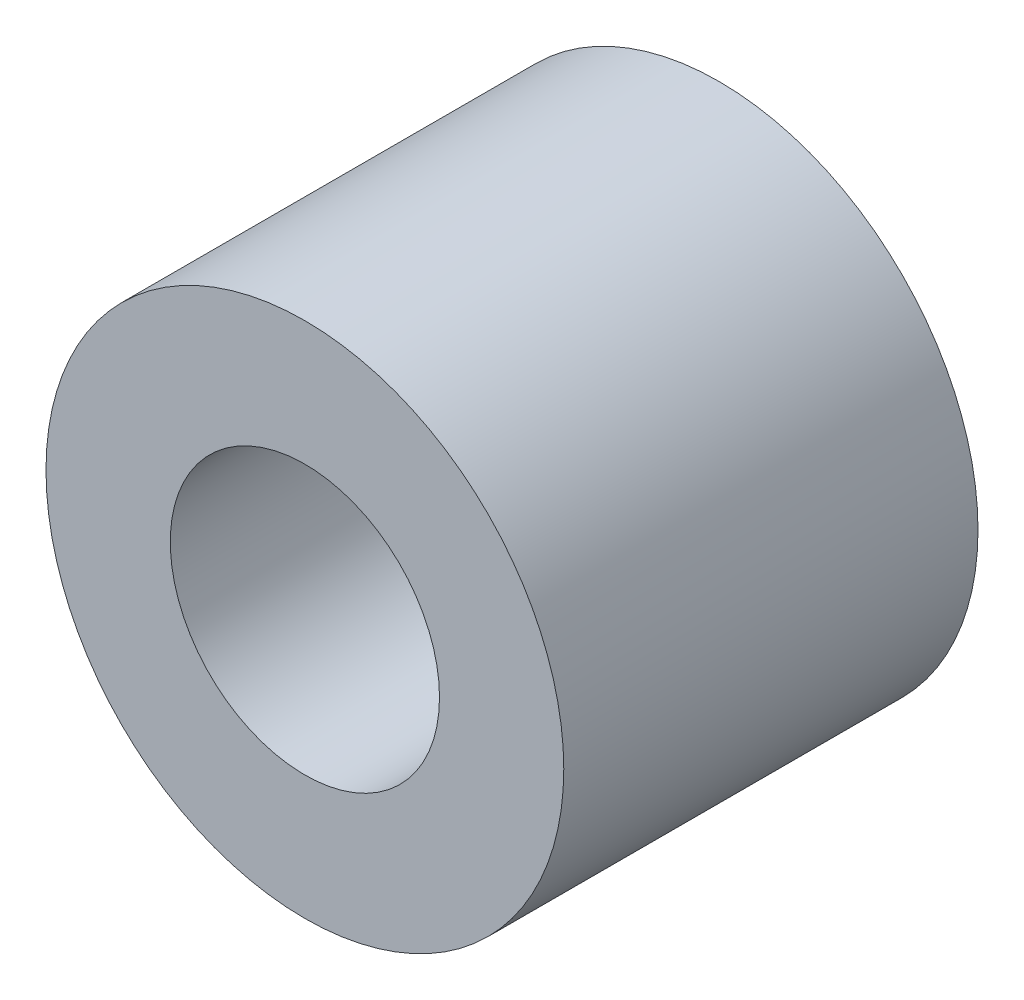
from build123d import *

# Parameters (mm, degrees)
SKETCH1_R           = 3.175
SKETCH1_R_2         = 1.651
BOSS_EXTRUDE1_DEPTH = 5.08


with BuildPart() as part:
    # Sketch1 → Boss-Extrude1 (new body)
    with BuildSketch(Plane.XY):
        Circle(SKETCH1_R)
        Circle(SKETCH1_R_2, mode=Mode.SUBTRACT)
    extrude(amount=BOSS_EXTRUDE1_DEPTH)


solid = part.part
